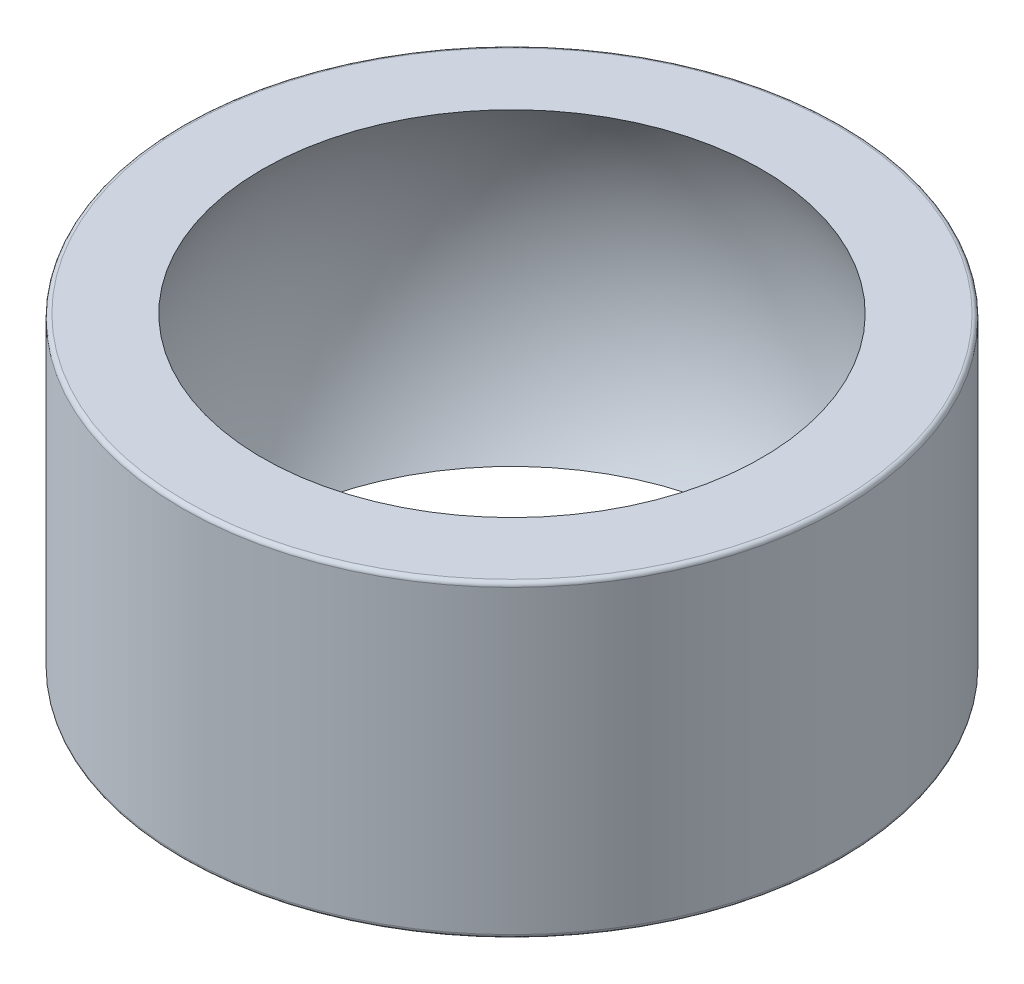
from build123d import *

# Parameters (mm, degrees)
SZKIC1_R                    = 16
DODANIE_WYCI_GNI_CIE1_DEPTH = 7.5
ZAOKR_GLENIE1_R             = 0.2


with BuildPart() as part:
    # Szkic1 → Dodanie-wyciągnięcie1 (new, symmetric)
    with BuildSketch(Plane(origin=(0, 0, 0), x_dir=(1, 0, 0), z_dir=(0, 1, 0))):
        with Locations(Location((0, 0, 0), (0, 0, 270))):
            Circle(SZKIC1_R)
    extrude(amount=DODANIE_WYCI_GNI_CIE1_DEPTH, both=True)

    # Szkic3 → Wycięcie-obrót1 (revolve, cut)
    with BuildSketch(Plane.XY):
        with BuildLine():
            Line((0, -14.26), (0, 14.26))
            ThreePointArc((0, 14.26), (14.26, 0), (0, -14.26))
        make_face()
    revolve(axis=Axis((0, -14.26, 0), (0, 1, 0)), mode=Mode.SUBTRACT)

    # Zaokrąglenie1
    zaokr_glenie1_edges = [part.edges().sort_by_distance(p)[0] for p in [
        (0, -7.5, -16),
        (0, 7.5, -16),
    ]]
    fillet(zaokr_glenie1_edges, radius=ZAOKR_GLENIE1_R)


solid = part.part
